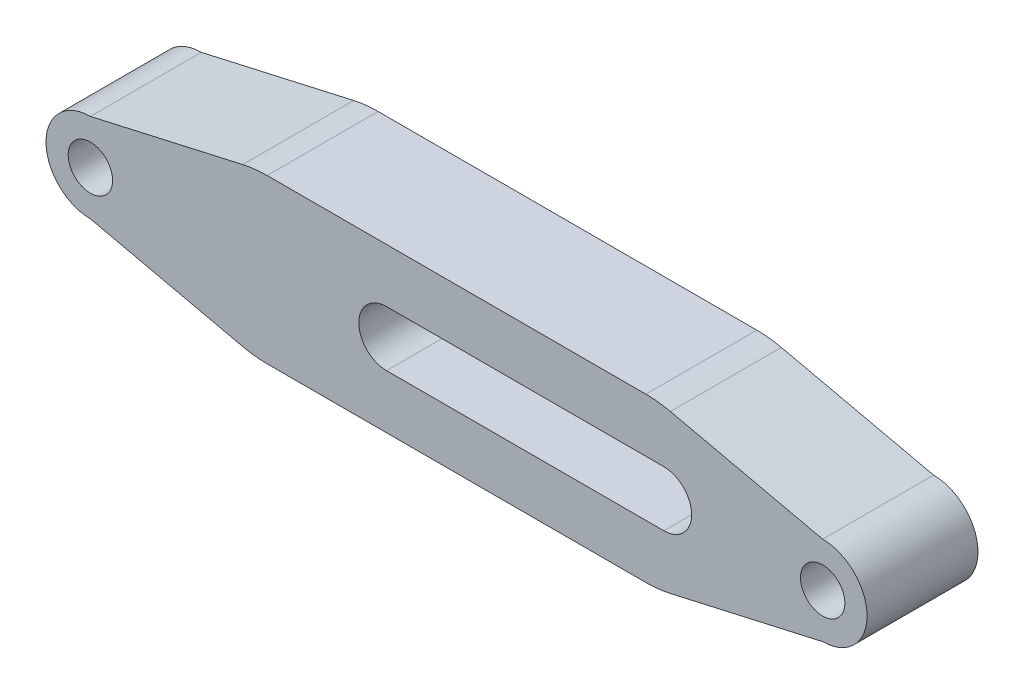
from build123d import *

# Parameters (mm, degrees)
CROQUIS1_R              = 2
SALIENTE_EXTRUIR1_DEPTH = 10
REDONDEO2_R             = 10
CORTAR_EXTRUIR1_DEPTH   = 10


with BuildPart() as part:
    # Croquis1 → Saliente-Extruir1 (new body)
    with BuildSketch(Plane.XY):
        with BuildLine():
            Line((14.815, 7.35), (51.185, 7.35))
            Line((51.185, 7.35), (66, 4))
            ThreePointArc((66, 4), (70, 0), (66, -4))
            Line((66, -4), (51.185, -7.35))
            Line((51.185, -7.35), (14.815, -7.35))
            Line((14.815, -7.35), (0, -4))
            ThreePointArc((0, -4), (-4, 0), (0, 4))
            Line((0, 4), (14.815, 7.35))
        make_face()
        Circle(CROQUIS1_R, mode=Mode.SUBTRACT)
        with Locations((66, 0)):
            Circle(CROQUIS1_R, mode=Mode.SUBTRACT)
    extrude(amount=SALIENTE_EXTRUIR1_DEPTH)

    # Redondeo2
    redondeo2_edges = [part.edges().sort_by_distance(p)[0] for p in [
        (14.815, 7.35, 5),
        (51.185, 7.35, 5),
        (51.185, -7.35, 5),
        (14.815, -7.35, 5),
    ]]
    fillet(redondeo2_edges, radius=REDONDEO2_R)

    # Croquis2 → Cortar-Extruir1 (cut)
    with BuildSketch(Plane.XY):
        with BuildLine():
            Line((51.69, 2.5), (26.69, 2.5))
            ThreePointArc((26.69, 2.5), (24.19, 0), (26.69, -2.5))
            Line((26.69, -2.5), (51.69, -2.5))
            ThreePointArc((51.69, -2.5), (54.19, 0), (51.69, 2.5))
        make_face()
    extrude(amount=CORTAR_EXTRUIR1_DEPTH, mode=Mode.SUBTRACT)


solid = part.part
